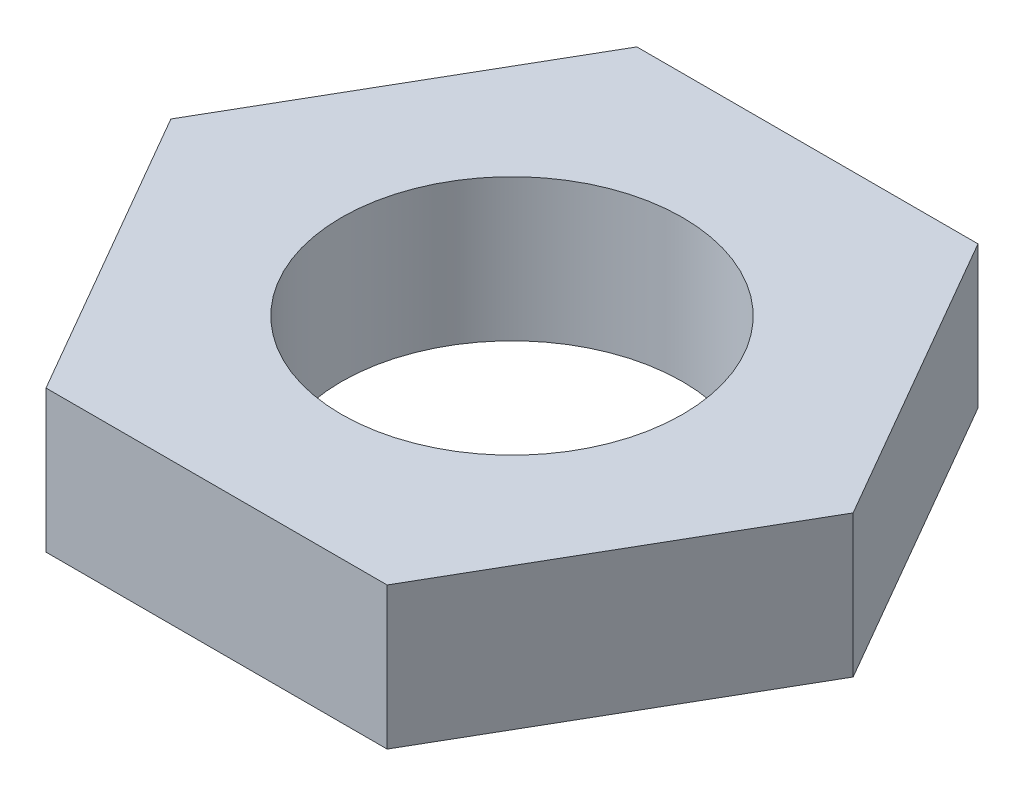
from build123d import *

# Parameters (mm, degrees)
SKETCH1_R           = 12
BOSS_EXTRUDE1_DEPTH = 10


with BuildPart() as part:
    # Sketch1 → Boss-Extrude1 (new body)
    with BuildSketch(Plane(origin=(0, 0, 0), x_dir=(1, 0, 0), z_dir=(0, 1, 0))):
        Polygon((12, -20.784609691), (24, 0), (12, 20.784609691), (-12, 20.784609691), (-24, 0), (-12, -20.784609691), align=None)
        with Locations(Location((0, 0, 0), (0, 0, 270))):
            Circle(SKETCH1_R, mode=Mode.SUBTRACT)
    extrude(amount=BOSS_EXTRUDE1_DEPTH)


solid = part.part
